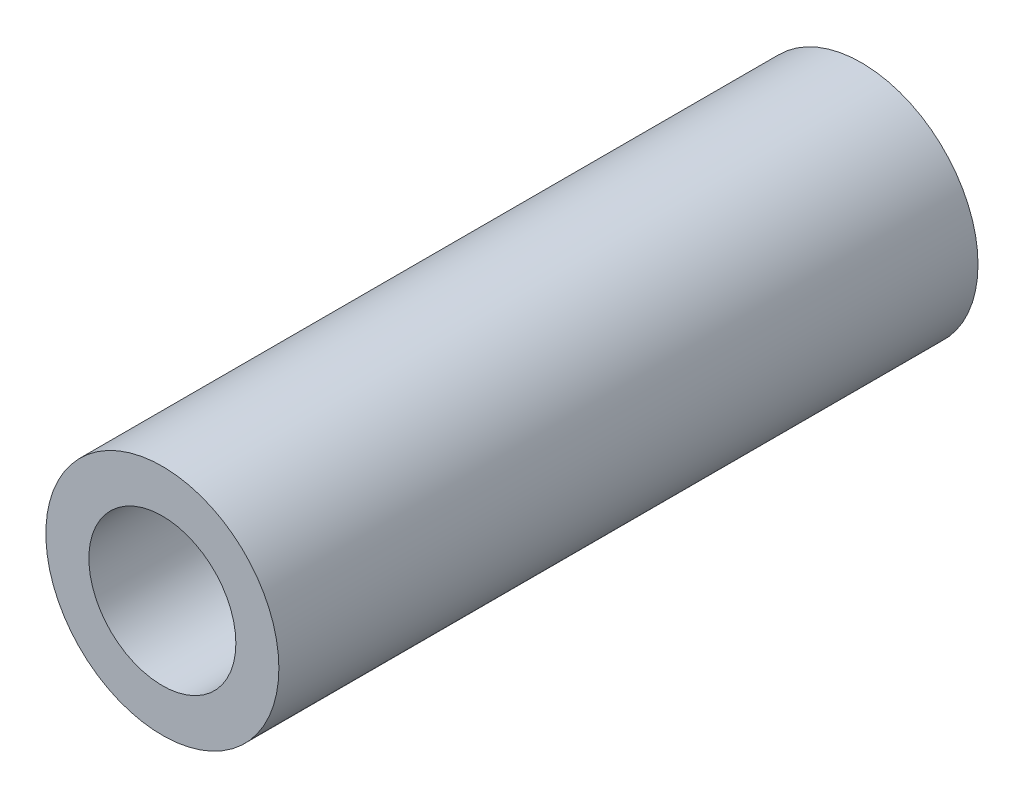
from build123d import *

# Parameters (mm, degrees)
CROQUIS1_R              = 3.25
CROQUIS1_R_2            = 2.05
SALIENTE_EXTRUIR1_DEPTH = 19.5


with BuildPart() as part:
    # Croquis1 → Saliente-Extruir1 (new body)
    with BuildSketch(Plane.XY):
        Circle(CROQUIS1_R)
        Circle(CROQUIS1_R_2, mode=Mode.SUBTRACT)
    extrude(amount=SALIENTE_EXTRUIR1_DEPTH)


solid = part.part
